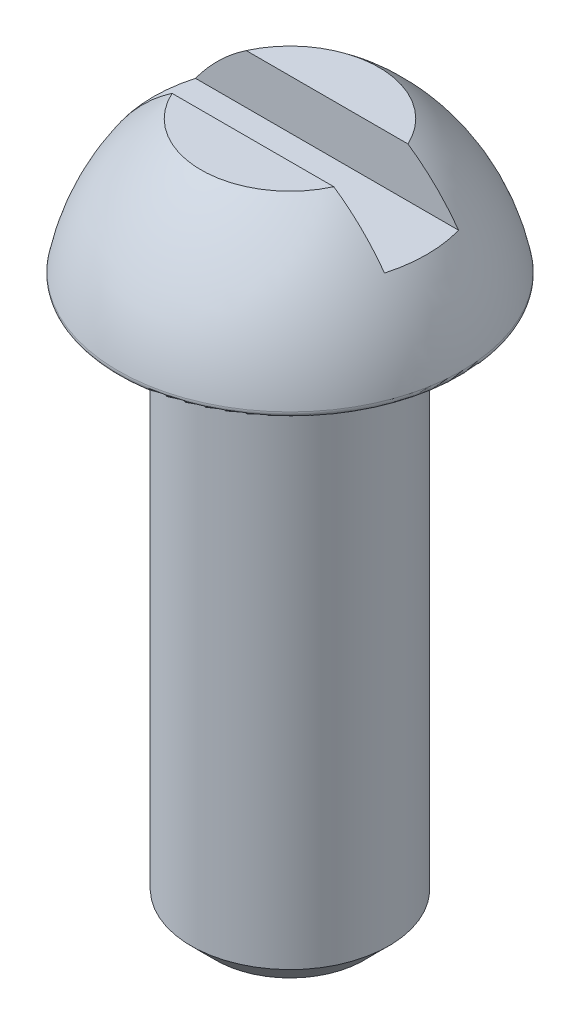
from build123d import *

# Parameters (mm, degrees)
FILLET_1_R          = 0.1
SKETCH_3_W          = 8
SKETCH_3_H          = 1.5
CUT_EXTRUDE_2_DEPTH = 1


with BuildPart() as part:
    # Эскиз1 → Повернуть1 (revolve)
    with BuildSketch(Plane.XY):
        with BuildLine():
            Line((3.5, 11.2), (2, 11.2))
            Line((2, 11.2), (2, 0.5))
            Line((2, 0.5), (1.5, 0))
            Line((1.5, 0), (0, 0))
            Line((0, 0), (0, 14))
            Line((0, 14), (1.8, 14))
            ThreePointArc((1.8, 14), (2.920275695, 12.764095958), (3.5, 11.2))
        make_face()
    revolve(axis=Axis((0, 0, 0), (0, 1, 0)))

    # Скругление1
    fillet_1_edges = [part.edges().sort_by_distance(p)[0] for p in [
        (-3.5, 11.2, 0),
    ]]
    fillet(fillet_1_edges, radius=FILLET_1_R)

    # Эскиз3 → Вырез-Вытянуть2 (cut)
    with BuildSketch(Plane(origin=(0, 14, 0), x_dir=(-1, 0, 0), z_dir=(0, 1, 0))):
        Rectangle(SKETCH_3_W, SKETCH_3_H)
    extrude(amount=-CUT_EXTRUDE_2_DEPTH, mode=Mode.SUBTRACT)


solid = part.part
